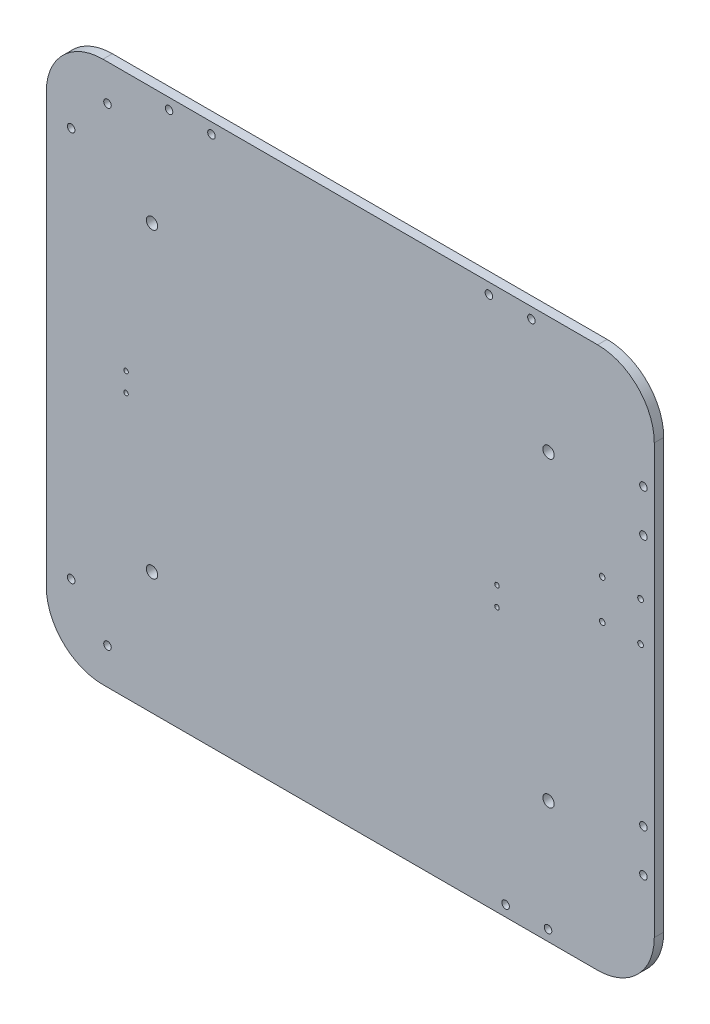
from build123d import *

# Parameters (mm, degrees)
SKETCH1_R           = 1.5
SKETCH1_R_2         = 3
SKETCH1_R_3         = 1.2
SKETCH1_R_4         = 2
BOSS_EXTRUDE1_DEPTH = 5


with BuildPart() as part:
    # Sketch1 → Boss-Extrude1 (new body)
    with BuildSketch(Plane.XY):
        with BuildLine():
            Line((-26, -224.7), (236, -224.7))
            ThreePointArc((236, -224.7), (257.213203436, -215.913203436), (266, -194.7))
            Line((266, -194.7), (266, 32.2))
            ThreePointArc((266, 32.2), (257.213203436, 53.413203436), (236, 62.2))
            Line((236, 62.2), (-26, 62.2))
            ThreePointArc((-26, 62.2), (-47.213203436, 53.413203436), (-56, 32.2))
            Line((-56, 32.2), (-56, -194.7))
            ThreePointArc((-56, -194.7), (-47.213203436, -215.913203436), (-26, -224.7))
        make_face()
        with Locations((238.425254173, -63.7)):
            Circle(SKETCH1_R, mode=Mode.SUBTRACT)
        with Locations((258.725254173, -63.7)):
            Circle(SKETCH1_R, mode=Mode.SUBTRACT)
        with Locations((258.725254173, -43)):
            Circle(SKETCH1_R, mode=Mode.SUBTRACT)
        with Locations((238.425254173, -43)):
            Circle(SKETCH1_R, mode=Mode.SUBTRACT)
        with Locations((210, -160)):
            Circle(SKETCH1_R_2, mode=Mode.SUBTRACT)
        with Locations((-13.76456221, -84.8)):
            Circle(SKETCH1_R_3, mode=Mode.SUBTRACT)
        with Locations((210, 0)):
            Circle(SKETCH1_R_2, mode=Mode.SUBTRACT)
        with Locations((-13.76456221, -74.7)):
            Circle(SKETCH1_R_3, mode=Mode.SUBTRACT)
        Circle(SKETCH1_R_2, mode=Mode.SUBTRACT)
        with Locations((182.699956565, -84.8)):
            Circle(SKETCH1_R_3, mode=Mode.SUBTRACT)
        with Locations((182.699956565, -74.7)):
            Circle(SKETCH1_R_3, mode=Mode.SUBTRACT)
        with Locations((0, -160)):
            Circle(SKETCH1_R_2, mode=Mode.SUBTRACT)
        with Locations((260.24999999, -146.497556717)):
            Circle(SKETCH1_R_4, mode=Mode.SUBTRACT)
        with Locations((260.24999999, -168.976787333)):
            Circle(SKETCH1_R_4, mode=Mode.SUBTRACT)
        with Locations((260.24999999, -13.147821573)):
            Circle(SKETCH1_R_4, mode=Mode.SUBTRACT)
        with Locations((260.24999999, 9.331409043)):
            Circle(SKETCH1_R_4, mode=Mode.SUBTRACT)
        with Locations((200.91673127, 56.44999999)):
            Circle(SKETCH1_R_4, mode=Mode.SUBTRACT)
        with Locations((178.437500654, 56.44999999)):
            Circle(SKETCH1_R_4, mode=Mode.SUBTRACT)
        with Locations((31.487656176, 56.44999999)):
            Circle(SKETCH1_R_4, mode=Mode.SUBTRACT)
        with Locations((9.00842556, 56.44999999)):
            Circle(SKETCH1_R_4, mode=Mode.SUBTRACT)
        with Locations((-23.580317145, 43.046459283)):
            Circle(SKETCH1_R_4, mode=Mode.SUBTRACT)
        with Locations((-42.818323589, 22.127225316)):
            Circle(SKETCH1_R_4, mode=Mode.SUBTRACT)
        with Locations((-42.818323589, -184.627225316)):
            Circle(SKETCH1_R_4, mode=Mode.SUBTRACT)
        with Locations((-23.580317145, -205.546459283)):
            Circle(SKETCH1_R_4, mode=Mode.SUBTRACT)
        with Locations((187.248977455, -218.94999999)):
            Circle(SKETCH1_R_4, mode=Mode.SUBTRACT)
        with Locations((209.728208071, -218.94999999)):
            Circle(SKETCH1_R_4, mode=Mode.SUBTRACT)
    extrude(amount=BOSS_EXTRUDE1_DEPTH)


solid = part.part
